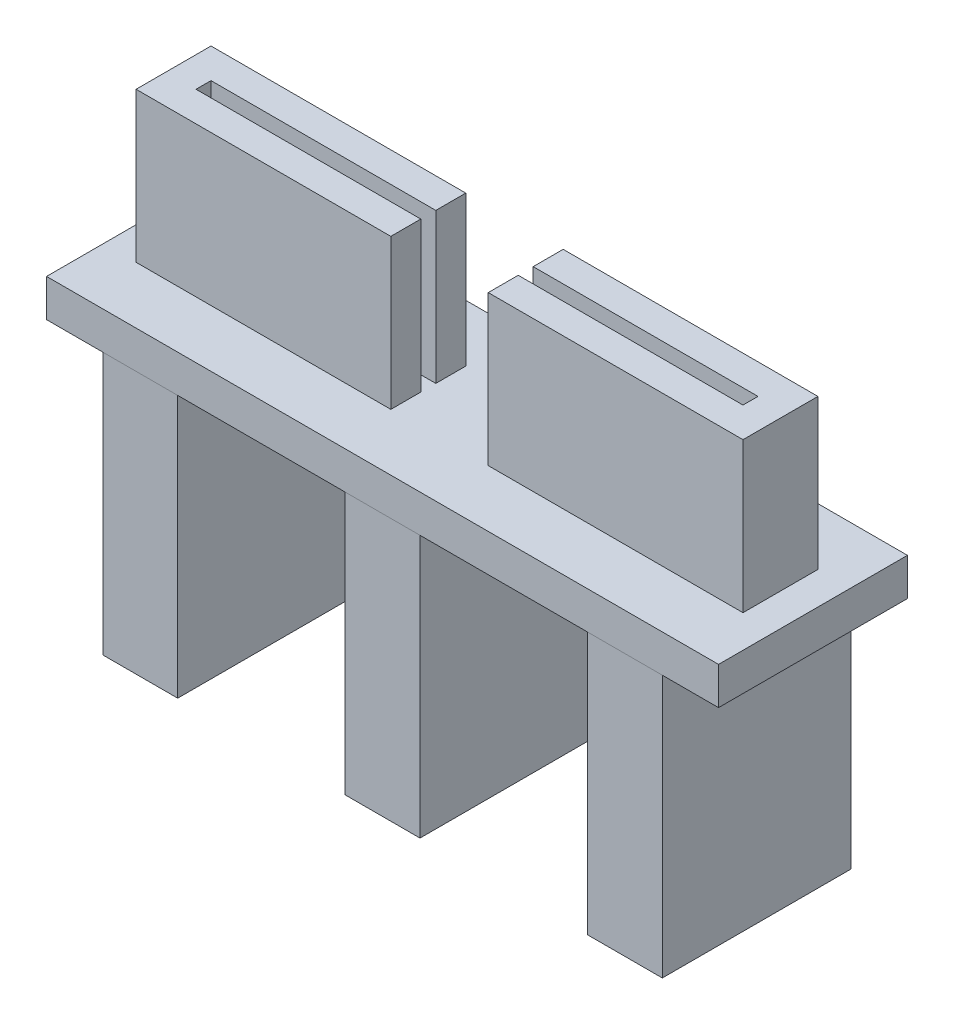
from build123d import *

# Parameters (mm, degrees)
SKETCH1_W            = 140
SKETCH1_H            = 100
BOSS_EXTRUDE2_DEPTH  = 40
BOSS_EXTRUDE2_TAPER  = 20
SHELL1_T             = -5
BOSS_EXTRUDE3_REACH  = 96.868
SKETCH4_W            = 10
SKETCH4_H            = 89.358222276
SKETCH8_W            = 10
SKETCH8_H            = 10
BOSS_EXTRUDE4_DEPTH  = 30
BOSS_EXTRUDE5_REACH  = 126.987
BOSS_EXTRUDE6_DEPTH  = 20
SKETCH13_R           = 3.25
CUT_EXTRUDE2_DEPTH   = 129.840987391
SKETCH14_R           = 3.25
CUT_EXTRUDE3_DEPTH   = 111.905365172
SKETCH15_OUTSIDE_W   = 180.832
SKETCH15_OUTSIDE_H   = 140.832
SKETCH15_OUTSIDE_W_2 = 89.684431162
SKETCH15_OUTSIDE_H_2 = 25.21083088
CUT_EXTRUDE6_DEPTH   = 111.905365172


with BuildPart() as part:
    # Sketch1 → Boss-Extrude2 (new body)
    with BuildSketch(Plane(origin=(0, 0, 0), x_dir=(1, 0, 0), z_dir=(0, 1, 0))):
        Rectangle(SKETCH1_W, SKETCH1_H)
    extrude(amount=BOSS_EXTRUDE2_DEPTH, taper=BOSS_EXTRUDE2_TAPER)

    # Shell1
    shell1_openings = [part.faces().sort_by_distance(p)[0] for p in [
        (0, 0, 0),
    ]]
    offset(amount=SHELL1_T, openings=shell1_openings, kind=Kind.INTERSECTION)


with BuildPart() as body_2:

    # Sketch4 → Boss-Extrude3 (new, up to next)
    with BuildSketch(Plane.XZ, mode=Mode.PRIVATE) as boss_extrude3_sk1:
        with Locations((-32.339555569, 0)):
            Rectangle(SKETCH4_W, SKETCH4_H)
    boss_extrude3_tool1 = extrude(boss_extrude3_sk1.sketch, amount=-BOSS_EXTRUDE3_REACH, mode=Mode.PRIVATE) - part.part
    # Sketch4 → Boss-Extrude3 (new, up to next)
    with BuildSketch(Plane.XZ, mode=Mode.PRIVATE) as boss_extrude3_sk2:
        with Locations((32.339555569, 0)):
            Rectangle(SKETCH4_W, SKETCH4_H)
    boss_extrude3_tool2 = extrude(boss_extrude3_sk2.sketch, amount=-BOSS_EXTRUDE3_REACH, mode=Mode.PRIVATE) - part.part
    # Sketch4 → Boss-Extrude3 (new, up to next)
    with BuildSketch(Plane.XZ, mode=Mode.PRIVATE) as boss_extrude3_sk3:
        Rectangle(SKETCH4_W, SKETCH4_H)
    boss_extrude3_tool3 = extrude(boss_extrude3_sk3.sketch, amount=-BOSS_EXTRUDE3_REACH, mode=Mode.PRIVATE) - part.part
    add(boss_extrude3_tool1.solids().sort_by_distance((-32.339556, 0, 0))[0])
    add(boss_extrude3_tool2.solids().sort_by_distance((32.339556, 0, 0))[0])
    add(boss_extrude3_tool3.solids().sort_by_distance((0, 0, 0))[0])


with BuildPart() as part_1:
    add(part.part)

    # Sketch8 → Boss-Extrude4 (add)
    with BuildSketch(Plane.XZ):
        with Locations((-32.339555569, 45)):
            Rectangle(SKETCH8_W, SKETCH8_H)
        with Locations((32.339555569, 45)):
            Rectangle(SKETCH8_W, SKETCH8_H)
    extrude(amount=BOSS_EXTRUDE4_DEPTH)

    # Boss-Extrude5: up to this face of the body (flat: up to its plane)
    boss_extrude5_end = Plane(body_2.part.faces().sort_by_distance((-37.339555569, 16.530131779, 0))[0])
    # Sketch9 → Boss-Extrude5 (add, up to the picked face)
    with BuildSketch(Plane(origin=(37.339555569, 0, 0), x_dir=(0, 0, -1), z_dir=(1, 0, 0)), mode=Mode.PRIVATE) as boss_extrude5_sk1:
        Polygon((-40, -15), (-25, 0), (-30, 0), (-40, -10), align=None)
    boss_extrude5_tool1 = split(extrude(boss_extrude5_sk1.sketch, amount=-BOSS_EXTRUDE5_REACH, mode=Mode.PRIVATE), bisect_by=boss_extrude5_end, keep=Keep.BOTH, mode=Mode.PRIVATE)
    add(boss_extrude5_tool1.solids().sort_by(Axis((37.339556, -6.333333, 33.666667), (-1, 0, 0)))[0])

    # Sketch12 → Boss-Extrude6 (add)
    with BuildSketch(Plane(origin=(0, 40, 0), x_dir=(1, 0, 0), z_dir=(0, 1, 0))):
        Polygon((-36.5, -1), (-36.5, 1), (-6.5, 1), (-6.5, 5), (-34.433278652, 5), (-40.5, 5), (-40.5, -5), (-36.5, -5), (-6.5, -5), (-6.5, -1), align=None)
        Polygon((40.5, 5), (40.5, -5), (36.5, -5), (6.5, -5), (6.5, -1), (36.5, -1), (36.5, 1), (6.5, 1), (6.5, 5), (34.433278652, 5), align=None)
    extrude(amount=BOSS_EXTRUDE6_DEPTH)

    # Sketch13 → Cut-Extrude2 (cut, through all)
    with BuildSketch(Plane(origin=(0, 0, 40), x_dir=(-1, 0, 0), z_dir=(0, 0, -1))):
        with Locations((-32.339555569, -22.5)):
            Circle(SKETCH13_R)
        with Locations(Location((32.339555569, -22.5, 0), (0, 0, 180))):
            Circle(SKETCH13_R)
    extrude(amount=-CUT_EXTRUDE2_DEPTH, mode=Mode.SUBTRACT)


with BuildPart() as cut_extrude3_tool:
    # Sketch14 → Cut-Extrude3 (new, through all)
    with BuildSketch(Plane(origin=(0, 40, 0), x_dir=(1, 0, 0), z_dir=(0, 1, 0))):
        with Locations(Location((-27.721190629, 23.631190629, 0), (0, 0, 270))):
            Circle(SKETCH14_R)
        with Locations(Location((27.721190629, 23.631190629, 0), (0, 0, 270))):
            Circle(SKETCH14_R)
        with BuildLine():
            ThreePointArc((3.25, -23.631190629), (2.298097039, -21.33309359), (0, -20.381190629))
            Line((0, -20.381190629), (0, -26.881190629))
            ThreePointArc((0, -26.881190629), (2.298097039, -25.929287668), (3.25, -23.631190629))
        make_face()
        with BuildLine():
            Line((0, -26.881190629), (0, -20.381190629))
            ThreePointArc((0, -20.381190629), (-3.25, -23.631190629), (0, -26.881190629))
        make_face()
    extrude(amount=-CUT_EXTRUDE3_DEPTH)


with BuildPart() as part_2:
    add(part_1.part)

    # Cut-Extrude3: cut by cut_extrude3_tool
    add(cut_extrude3_tool.part, mode=Mode.SUBTRACT)


with BuildPart() as body_2_1:
    add(body_2.part)

    # Cut-Extrude3: cut by cut_extrude3_tool
    add(cut_extrude3_tool.part, mode=Mode.SUBTRACT)


with BuildPart() as cut_extrude6_tool:
    # Sketch15 outside → Cut-Extrude6 (new, through all)
    with BuildSketch(Plane(origin=(0, 40, 0), x_dir=(1, 0, 0), z_dir=(0, 1, 0))):
        Rectangle(SKETCH15_OUTSIDE_W, SKETCH15_OUTSIDE_H)
        Rectangle(SKETCH15_OUTSIDE_W_2, SKETCH15_OUTSIDE_H_2, mode=Mode.SUBTRACT)
    extrude(amount=-CUT_EXTRUDE6_DEPTH)


with BuildPart() as part_3:
    add(part_2.part)

    # Cut-Extrude6: cut by cut_extrude6_tool
    add(cut_extrude6_tool.part, mode=Mode.SUBTRACT)


with BuildPart() as body_2_2:
    add(body_2_1.part)

    # Cut-Extrude6: cut by cut_extrude6_tool
    add(cut_extrude6_tool.part, mode=Mode.SUBTRACT)


solid = Compound([part_3.part, body_2_2.part])
